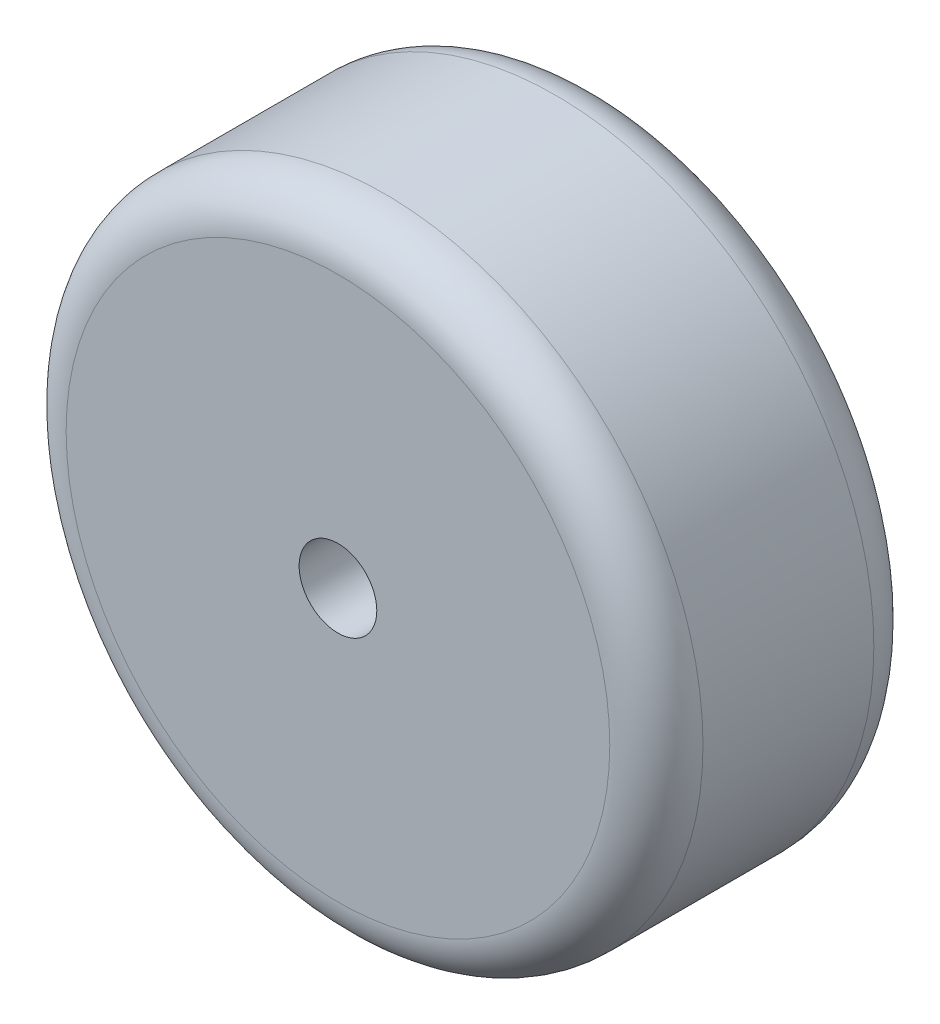
from build123d import *

# Parameters (mm, degrees)
SKETCH_1_R          = 20.5
EXTRUDE_1_DEPTH     = 17
SKETCH_2_R          = 2.5
CUT_EXTRUDE_1_DEPTH = 34.608034754
FILLET_1_R          = 3


with BuildPart() as part:
    # 草图1 → 凸台-拉伸1 (new body)
    with BuildSketch(Plane.XY):
        Circle(SKETCH_1_R)
    extrude(amount=EXTRUDE_1_DEPTH)

    # 草图2 → 切除-拉伸1 (cut, through all)
    with BuildSketch(Plane.XY.offset(17)):
        Circle(SKETCH_2_R)
    extrude(amount=-CUT_EXTRUDE_1_DEPTH, mode=Mode.SUBTRACT)

    # 圆角1
    fillet_1_edges = [part.edges().sort_by_distance(p)[0] for p in [
        (-20.5, 0, 0),
        (-20.5, 0, 17),
    ]]
    fillet(fillet_1_edges, radius=FILLET_1_R)


solid = part.part
